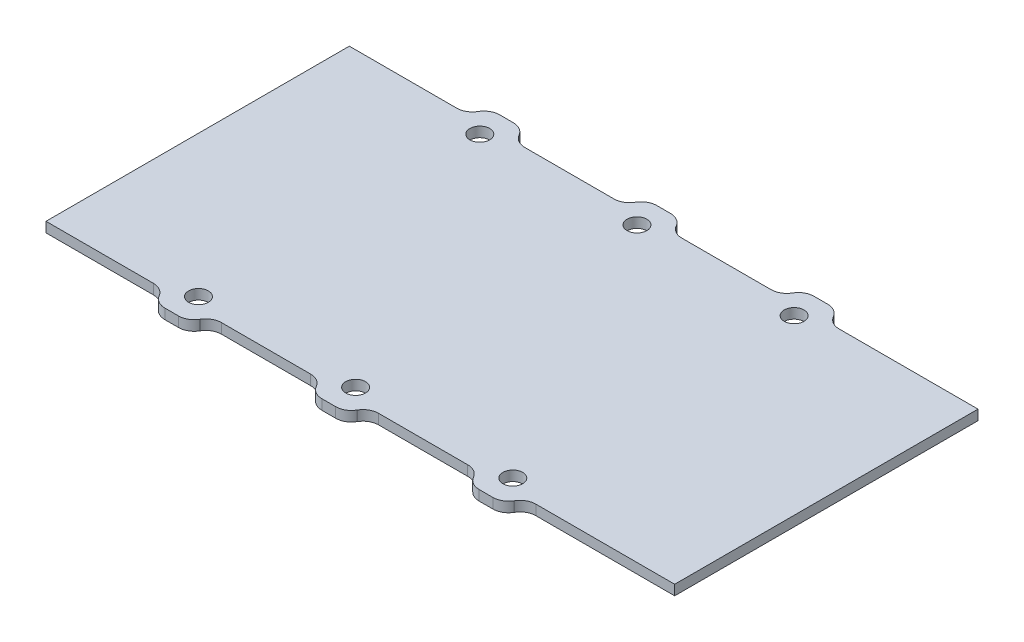
from build123d import *

# Parameters (mm, degrees)
SKETCH1_R           = 1.575
BOSS_EXTRUDE1_DEPTH = 1.6


with BuildPart() as part:
    # Sketch1 → Boss-Extrude1 (new body)
    with BuildSketch(Plane(origin=(0, 0, 0), x_dir=(1, 0, 0), z_dir=(0, 1, 0))):
        with BuildLine():
            Line((-50, 24.125), (-32.915475947, 24.125))
            ThreePointArc((-32.915475947, 24.125), (-31.68372891, 24.449500233), (-30.771743633, 25.338760611))
            Line((-30.771743633, 25.338760611), (-30.728256367, 25.411239389))
            ThreePointArc((-30.728256367, 25.411239389), (-29.81627109, 26.300499767), (-28.584524053, 26.625))
            Line((-28.584524053, 26.625), (-26.415475947, 26.625))
            ThreePointArc((-26.415475947, 26.625), (-25.18372891, 26.300499767), (-24.271743633, 25.411239389))
            Line((-24.271743633, 25.411239389), (-24.228256367, 25.338760611))
            ThreePointArc((-24.228256367, 25.338760611), (-23.31627109, 24.449500233), (-22.084524053, 24.125))
            Line((-22.084524053, 24.125), (-7.915475947, 24.125))
            ThreePointArc((-7.915475947, 24.125), (-6.68372891, 24.449500233), (-5.771743633, 25.338760611))
            Line((-5.771743633, 25.338760611), (-5.728256367, 25.411239389))
            ThreePointArc((-5.728256367, 25.411239389), (-4.81627109, 26.300499767), (-3.584524053, 26.625))
            Line((-3.584524053, 26.625), (-1.415475947, 26.625))
            ThreePointArc((-1.415475947, 26.625), (-0.18372891, 26.300499767), (0.728256367, 25.411239389))
            Line((0.728256367, 25.411239389), (0.771743633, 25.338760611))
            ThreePointArc((0.771743633, 25.338760611), (1.68372891, 24.449500233), (2.915475947, 24.125))
            Line((2.915475947, 24.125), (17.084524053, 24.125))
            ThreePointArc((17.084524053, 24.125), (18.31627109, 24.449500233), (19.228256367, 25.338760611))
            Line((19.228256367, 25.338760611), (19.271743633, 25.411239389))
            ThreePointArc((19.271743633, 25.411239389), (20.18372891, 26.300499767), (21.415475947, 26.625))
            Line((21.415475947, 26.625), (23.584524053, 26.625))
            ThreePointArc((23.584524053, 26.625), (24.81627109, 26.300499767), (25.728256367, 25.411239389))
            Line((25.728256367, 25.411239389), (25.771743633, 25.338760611))
            ThreePointArc((25.771743633, 25.338760611), (26.68372891, 24.449500233), (27.915475947, 24.125))
            Line((27.915475947, 24.125), (50, 24.125))
            Line((50, 24.125), (50, -24.125))
            Line((50, -24.125), (27.915475947, -24.125))
            ThreePointArc((27.915475947, -24.125), (26.68372891, -24.449500233), (25.771743633, -25.338760611))
            Line((25.771743633, -25.338760611), (25.728256367, -25.411239389))
            ThreePointArc((25.728256367, -25.411239389), (24.81627109, -26.300499767), (23.584524053, -26.625))
            Line((23.584524053, -26.625), (21.415475947, -26.625))
            ThreePointArc((21.415475947, -26.625), (20.18372891, -26.300499767), (19.271743633, -25.411239389))
            Line((19.271743633, -25.411239389), (19.228256367, -25.338760611))
            ThreePointArc((19.228256367, -25.338760611), (18.31627109, -24.449500233), (17.084524053, -24.125))
            Line((17.084524053, -24.125), (2.915475947, -24.125))
            ThreePointArc((2.915475947, -24.125), (1.68372891, -24.449500233), (0.771743633, -25.338760611))
            Line((0.771743633, -25.338760611), (0.728256367, -25.411239389))
            ThreePointArc((0.728256367, -25.411239389), (-0.18372891, -26.300499767), (-1.415475947, -26.625))
            Line((-1.415475947, -26.625), (-3.584524053, -26.625))
            ThreePointArc((-3.584524053, -26.625), (-4.81627109, -26.300499767), (-5.728256367, -25.411239389))
            Line((-5.728256367, -25.411239389), (-5.771743633, -25.338760611))
            ThreePointArc((-5.771743633, -25.338760611), (-6.68372891, -24.449500233), (-7.915475947, -24.125))
            Line((-7.915475947, -24.125), (-22.084524053, -24.125))
            ThreePointArc((-22.084524053, -24.125), (-23.31627109, -24.449500233), (-24.228256367, -25.338760611))
            Line((-24.228256367, -25.338760611), (-24.271743633, -25.411239389))
            ThreePointArc((-24.271743633, -25.411239389), (-25.18372891, -26.300499767), (-26.415475947, -26.625))
            Line((-26.415475947, -26.625), (-28.584524053, -26.625))
            ThreePointArc((-28.584524053, -26.625), (-29.81627109, -26.300499767), (-30.728256367, -25.411239389))
            Line((-30.728256367, -25.411239389), (-30.771743633, -25.338760611))
            ThreePointArc((-30.771743633, -25.338760611), (-31.68372891, -24.449500233), (-32.915475947, -24.125))
            Line((-32.915475947, -24.125), (-50, -24.125))
            Line((-50, -24.125), (-50, 24.125))
        make_face()
        with Locations(Location((-27.5, -22.375, 0), (0, 0, 270))):
            Circle(SKETCH1_R, mode=Mode.SUBTRACT)
        with Locations(Location((-27.5, 22.375, 0), (0, 0, 90))):
            Circle(SKETCH1_R, mode=Mode.SUBTRACT)
        with Locations(Location((-2.5, 22.375, 0), (0, 0, 90))):
            Circle(SKETCH1_R, mode=Mode.SUBTRACT)
        with Locations(Location((-2.5, -22.375, 0), (0, 0, 270))):
            Circle(SKETCH1_R, mode=Mode.SUBTRACT)
        with Locations(Location((22.5, 22.375, 0), (0, 0, 90))):
            Circle(SKETCH1_R, mode=Mode.SUBTRACT)
        with Locations(Location((22.5, -22.375, 0), (0, 0, 270))):
            Circle(SKETCH1_R, mode=Mode.SUBTRACT)
    extrude(amount=BOSS_EXTRUDE1_DEPTH)


solid = part.part
